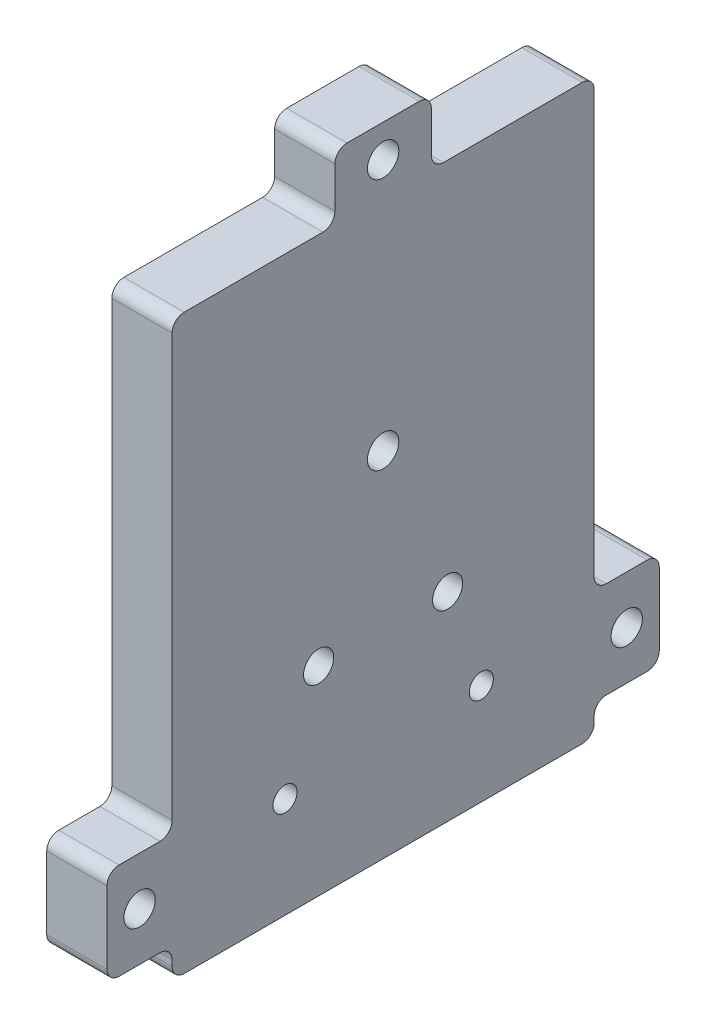
from build123d import *

# Parameters (mm, degrees)
SKETCH11_W          = 38.1
SKETCH11_H          = 53.975
SKETCH11_R          = 1.651
SKETCH11_R_2        = 1.5875
SKETCH11_R_3        = 1.27
BOSS_EXTRUDE1_DEPTH = 3.175
SKETCH12_W          = 44.45
SKETCH12_H          = 60.325
SKETCH12_W_2        = 38.1
SKETCH12_H_2        = 53.975
BOSS_EXTRUDE2_DEPTH = 6.35
SKETCH13_W          = 6.858
SKETCH13_H          = 10.16
SKETCH13_R          = 1.651
SKETCH13_W_2        = 10.16
SKETCH13_H_2        = 6.858
BOSS_EXTRUDE3_DEPTH = 6.35
SKETCH14_R          = 3.6195
SKETCH14_R_2        = 1.5875
SKETCH14_R_3        = 3.302
SKETCH14_R_4        = 1.27
BOSS_EXTRUDE4_DEPTH = 10.16
FILLET2_R           = 1.27


with BuildPart() as part:
    # Sketch11 → Boss-Extrude1 (new body)
    with BuildSketch(Plane(origin=(0, 0, 0), x_dir=(0, 0, -1), z_dir=(1, 0, 0))):
        with Locations((0, 9.2075)):
            Rectangle(SKETCH11_W, SKETCH11_H)
        with Locations((0, 16.256)):
            Circle(SKETCH11_R, mode=Mode.SUBTRACT)
        with Locations((6.7945, 0)):
            Circle(SKETCH11_R_2, mode=Mode.SUBTRACT)
        with Locations((10.336274795, -10.336274795)):
            Circle(SKETCH11_R_3, mode=Mode.SUBTRACT)
        with Locations(Location((-10.336274795, -10.336274795, 0), (0, 0, 180))):
            Circle(SKETCH11_R_3, mode=Mode.SUBTRACT)
        with Locations(Location((-6.7945, 0, 0), (0, 0, 180))):
            Circle(SKETCH11_R_2, mode=Mode.SUBTRACT)
    extrude(amount=-BOSS_EXTRUDE1_DEPTH)

    # Sketch12 → Boss-Extrude2 (add)
    with BuildSketch(Plane(origin=(0, 0, 0), x_dir=(0, 0, -1), z_dir=(1, 0, 0))):
        with Locations((0, 9.2075)):
            Rectangle(SKETCH12_W, SKETCH12_H)
        with Locations((0, 9.2075)):
            Rectangle(SKETCH12_W_2, SKETCH12_H_2, mode=Mode.SUBTRACT)
    extrude(amount=-BOSS_EXTRUDE2_DEPTH)

    # Sketch13 → Boss-Extrude3 (add)
    # profile 1 of 3: a face of its own
    with BuildSketch(Plane(origin=(0, 0, 0), x_dir=(0, 0, -1), z_dir=(1, 0, 0))):
        with Locations((-25.654, -12.7)):
            Rectangle(SKETCH13_W, SKETCH13_H)
        with Locations((-25.654, -12.7)):
            Circle(SKETCH13_R, mode=Mode.SUBTRACT)
    # profile 2 of 3: a face of its own
    with BuildSketch(Plane(origin=(0, 0, 0), x_dir=(0, 0, -1), z_dir=(1, 0, 0))):
        with Locations((0, 42.799)):
            Rectangle(SKETCH13_W_2, SKETCH13_H_2)
        with Locations((0, 42.799)):
            Circle(SKETCH13_R, mode=Mode.SUBTRACT)
    # profile 3 of 3: a face of its own
    with BuildSketch(Plane(origin=(0, 0, 0), x_dir=(0, 0, -1), z_dir=(1, 0, 0))):
        with Locations((25.654, -12.7)):
            Rectangle(SKETCH13_W, SKETCH13_H)
        with Locations((25.654, -12.7)):
            Circle(SKETCH13_R, mode=Mode.SUBTRACT)
    extrude(amount=-BOSS_EXTRUDE3_DEPTH)

    # Sketch14 → Boss-Extrude4 (add)
    # profile 1 of 4: a face of its own
    with BuildSketch(Plane.ZY.offset(3.175)):
        with Locations(Location((-6.7945, 0, 0), (0, 0, 180))):
            Circle(SKETCH14_R)
        with Locations(Location((-6.7945, 0, 0), (0, 0, 180))):
            Circle(SKETCH14_R_2, mode=Mode.SUBTRACT)
    # profile 2 of 4: a face of its own
    with BuildSketch(Plane.ZY.offset(3.175)):
        with Locations(Location((6.7945, 0, 0), (0, 0, 180))):
            Circle(SKETCH14_R)
        with Locations((6.7945, 0)):
            Circle(SKETCH14_R_2, mode=Mode.SUBTRACT)
    # profile 3 of 4: a face of its own
    with BuildSketch(Plane.ZY.offset(3.175)):
        with Locations(Location((-10.336274795, -10.336274795, 0), (0, 0, 180))):
            Circle(SKETCH14_R_3)
        with Locations(Location((-10.336274795, -10.336274795, 0), (0, 0, 180))):
            Circle(SKETCH14_R_4, mode=Mode.SUBTRACT)
    # profile 4 of 4: a face of its own
    with BuildSketch(Plane.ZY.offset(3.175)):
        with Locations(Location((10.336274795, -10.336274795, 0), (0, 0, 180))):
            Circle(SKETCH14_R_3)
        with Locations((10.336274795, -10.336274795)):
            Circle(SKETCH14_R_4, mode=Mode.SUBTRACT)
    extrude(amount=BOSS_EXTRUDE4_DEPTH)

    # Fillet2
    fillet2_edges = [part.edges().sort_by_distance(p)[0] for p in [
        (-3.175, 39.37, 22.225),
        (-3.175, 39.37, -22.225),
        (-3.175, -20.955, -22.225),
        (-3.175, -20.955, 22.225),
        (-3.175, -7.62, 29.083),
        (-3.175, -17.78, 29.083),
        (-3.175, -17.78, 22.225),
        (-3.175, -7.62, 22.225),
        (-3.175, 46.228, 5.08),
        (-3.175, 39.37, 5.08),
        (-3.175, 39.37, -5.08),
        (-3.175, 46.228, -5.08),
        (-3.175, -17.78, -29.083),
        (-3.175, -7.62, -29.083),
        (-3.175, -7.62, -22.225),
        (-3.175, -17.78, -22.225),
    ]]
    fillet(fillet2_edges, radius=FILLET2_R)


solid = part.part
